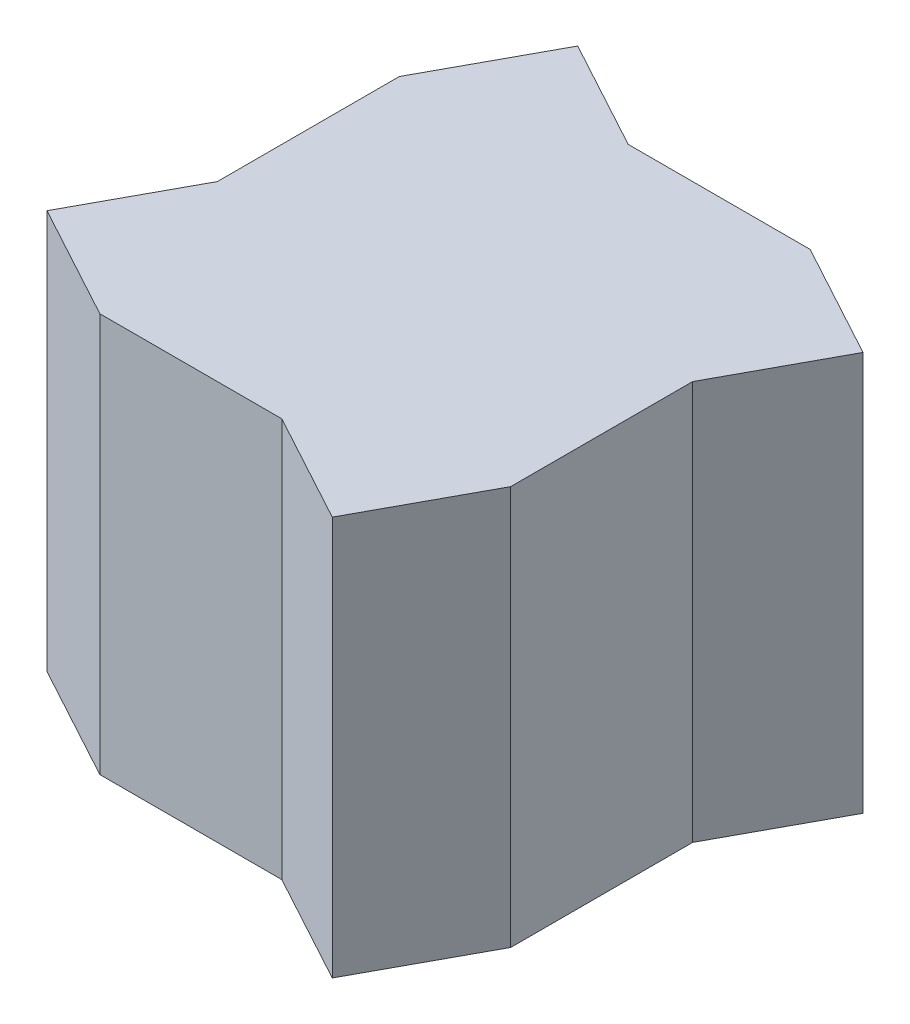
from build123d import *

# Parameters (mm, degrees)
BOSS_EXTRUDE1_DEPTH = 34


with BuildPart() as part:
    # Sketch1 → Boss-Extrude1 (new body)
    with BuildSketch(Plane(origin=(0, 0, 0), x_dir=(1, 0, 0), z_dir=(0, 1, 0))):
        Polygon((-17.5, 12.753927132), (-12.151761569, 22.605945295), (-2.746072868, 17.5), (12.753927132, 17.5), (22.605945295, 12.151761569), (17.5, 2.746072868), (17.5, -12.753927132), (12.151761569, -22.605945295), (2.746072868, -17.5), (-12.753927132, -17.5), (-22.605945295, -12.151761569), (-17.5, -2.746072868), align=None)
    extrude(amount=BOSS_EXTRUDE1_DEPTH)


solid = part.part
